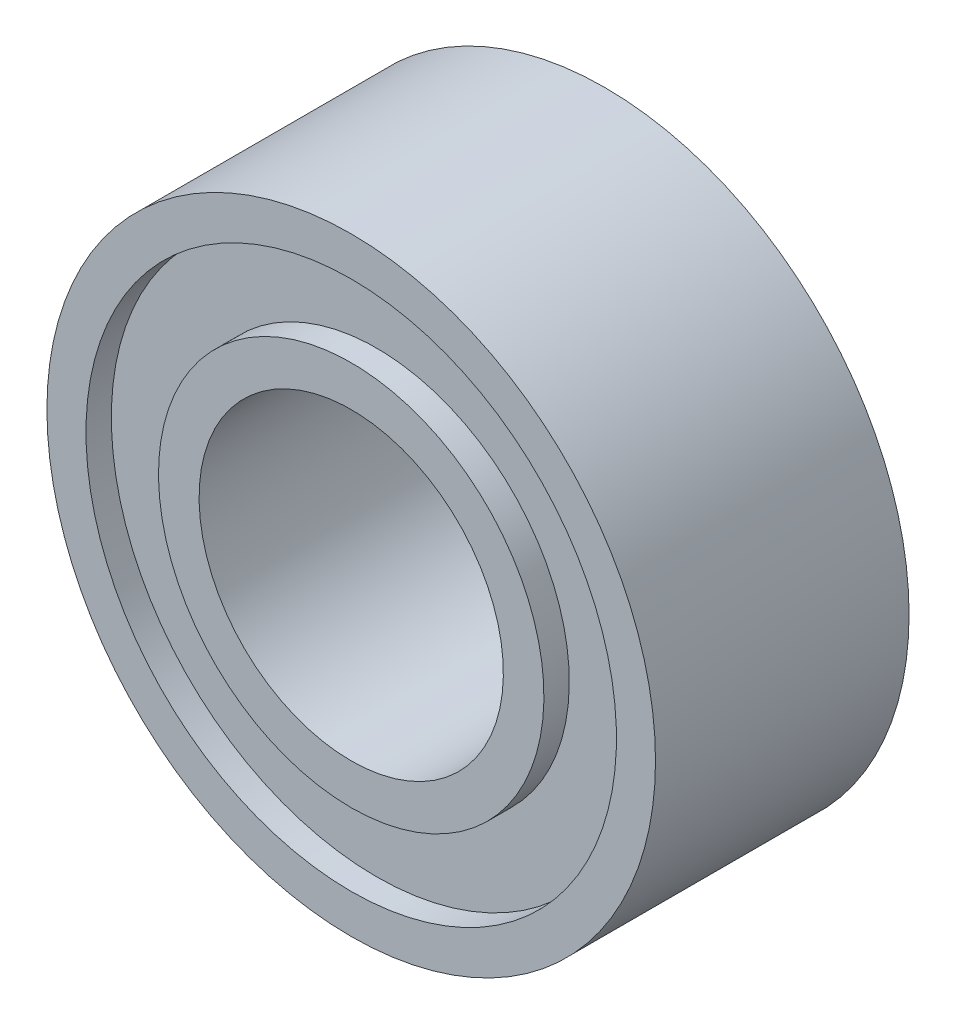
from build123d import *


with BuildPart() as part:
    # Sketch1 → Revolve1 (revolve)
    with BuildSketch(Plane(origin=(0, 0, 0), x_dir=(0, 0, -1), z_dir=(1, 0, 0)), mode=Mode.PRIVATE) as revolve1_sk:
        Polygon((-1.25, 3), (1.25, 3), (1.25, 2.615), (1, 2.615), (1, 1.9), (1.25, 1.9), (1.25, 1.5), (-1.25, 1.5), (-1.25, 1.9), (-1, 1.9), (-1, 2.615), (-1.25, 2.615), align=None)
    revolve(revolve1_sk.sketch.rotate(Axis((0, 0, 1.25), (0, 0, -1)), 180), axis=Axis((0, 0, 1.25), (0, 0, -1)))


solid = part.part
